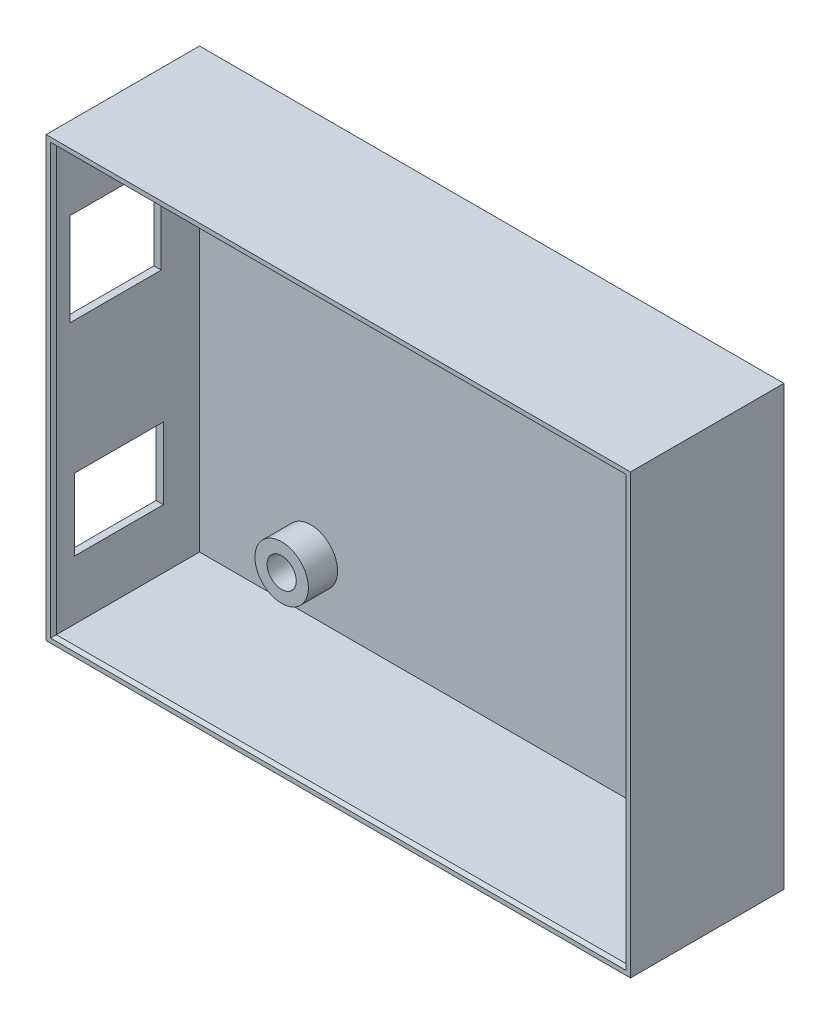
from build123d import *

# Parameters (mm, degrees)
SKETCH_1_W          = 80
SKETCH_1_H          = 60
EXTRUDE_1_DEPTH     = 2
SKETCH_2_W          = 80
SKETCH_2_H          = 60
SKETCH_2_W_2        = 78
SKETCH_2_H_2        = 58
EXTRUDE_2_DEPTH     = 20
CHAMFER_1_SIZE      = 1
SKETCH_3_W          = 12.489594438
SKETCH_3_H          = 12.7
SKETCH_3_W_2        = 12.168468818
SKETCH_3_H_2        = 9.816130436
CUT_EXTRUDE_1_DEPTH = 10
SKETCH_4_R          = 3.431381937
SKETCH_4_R_2        = 2
SKETCH_4_R_3        = 3.312453099
SKETCH_4_R_4        = 3.867665241
SKETCH_4_R_5        = 3.660588401
EXTRUDE_4_DEPTH     = 4
CHAMFER_2_SIZE      = 0.4


with BuildPart() as part:
    # Эскиз1 → Бобышка-Вытянуть1 (new body)
    with BuildSketch(Plane.XY):
        with Locations((18.021978022, -0.32967033)):
            Rectangle(SKETCH_1_W, SKETCH_1_H)
    extrude(amount=EXTRUDE_1_DEPTH)

    # Эскиз2 → Бобышка-Вытянуть2 (add)
    with BuildSketch(Plane.XY.offset(2)):
        with Locations((18.021978022, -0.32967033)):
            Rectangle(SKETCH_2_W, SKETCH_2_H)
        with Locations((18.021978022, -0.32967033)):
            Rectangle(SKETCH_2_W_2, SKETCH_2_H_2, mode=Mode.SUBTRACT)
    extrude(amount=EXTRUDE_2_DEPTH)

    # Фаска1
    chamfer_1_edges = [part.edges().sort_by_distance(p)[0] for p in [
        (18.021978022, 29.67032967, 0),
        (58.021978022, -0.32967033, 0),
        (18.021978022, -30.32967033, 0),
        (-21.978021978, -0.32967033, 0),
    ]]
    chamfer(chamfer_1_edges, length=CHAMFER_1_SIZE)

    # Эскиз3 → Вырез-Вытянуть1 (cut)
    with BuildSketch(Plane.ZY.offset(21.978021978)):
        with Locations((13.484797219, 13.07032967)):
            Rectangle(SKETCH_3_W, SKETCH_3_H)
        with Locations((13.033283453, -16.331339337)):
            Rectangle(SKETCH_3_W_2, SKETCH_3_H_2)
    extrude(amount=-CUT_EXTRUDE_1_DEPTH, mode=Mode.SUBTRACT)

    # Эскиз4 → Бобышка-Вытянуть4 (add)
    # profile 1 of 4: a face of its own
    with BuildSketch(Plane.XY.offset(2)):
        with Locations((-5.749056018, 26.121666888)):
            Circle(SKETCH_4_R)
        with Locations((-5.749056018, 26.121666888)):
            Circle(SKETCH_4_R_2, mode=Mode.SUBTRACT)
    # profile 2 of 4: a face of its own
    with BuildSketch(Plane.XY.offset(2)):
        with Locations((45.270920547, 10.86273616)):
            Circle(SKETCH_4_R_3)
        with Locations((45.270920547, 10.86273616)):
            Circle(SKETCH_4_R_2, mode=Mode.SUBTRACT)
    # profile 3 of 4: a face of its own
    with BuildSketch(Plane.XY.offset(2)):
        with Locations((45.285382916, -17.058588577)):
            Circle(SKETCH_4_R_4)
        with Locations((45.285382916, -17.058588577)):
            Circle(SKETCH_4_R_2, mode=Mode.SUBTRACT)
    # profile 4 of 4: a face of its own
    with BuildSketch(Plane.XY.offset(2)):
        with Locations((-5.732841378, -22.138175863)):
            Circle(SKETCH_4_R_5)
        with Locations((-5.732841378, -22.138175863)):
            Circle(SKETCH_4_R_2, mode=Mode.SUBTRACT)
    extrude(amount=EXTRUDE_4_DEPTH)

    # Фаска2
    chamfer_2_edges = [part.edges().sort_by_distance(p)[0] for p in [
        (18.021978022, 28.67032967, 22),
        (-20.978021978, -0.32967033, 22),
        (18.021978022, -29.32967033, 22),
        (57.021978022, -0.32967033, 22),
    ]]
    chamfer(chamfer_2_edges, length=CHAMFER_2_SIZE)


solid = part.part
